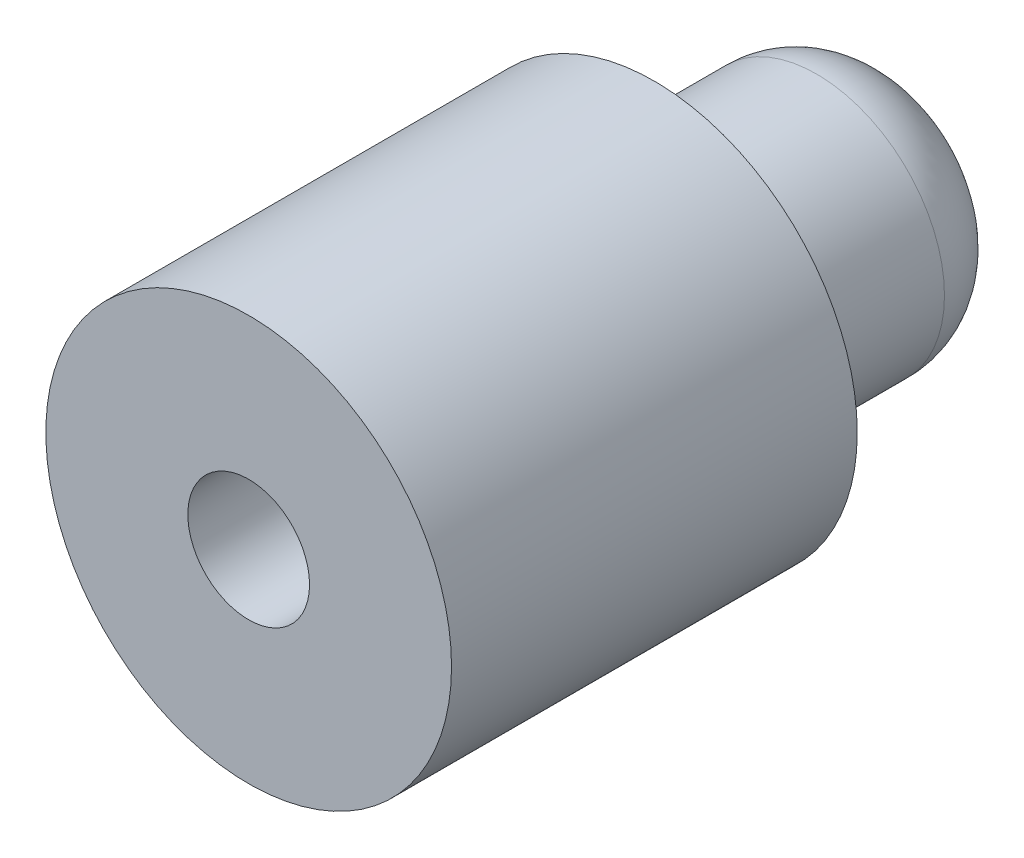
from build123d import *

# Parameters (mm, degrees)
ESQUISSE1_R             = 3.15
BOSS_EXTRU_1_DEPTH      = 6
ESQUISSE3_R             = 5
BOSS_EXTRU_2_DEPTH      = 10
ESQUISSE4_R             = 1.5
ENL_V_MAT_EXTRU_1_DEPTH = 10
CONG_1_R                = 2


with BuildPart() as part:
    # Esquisse1 → Boss.-Extru.1 (new body)
    with BuildSketch(Plane.XY):
        Circle(ESQUISSE1_R)
    extrude(amount=BOSS_EXTRU_1_DEPTH)

    # Esquisse3 → Boss.-Extru.2 (add)
    with BuildSketch(Plane.XY.offset(6)):
        Circle(ESQUISSE3_R)
    extrude(amount=BOSS_EXTRU_2_DEPTH)

    # Esquisse4 → Enlèv. mat.-Extru.1 (cut)
    with BuildSketch(Plane.XY.offset(16)):
        Circle(ESQUISSE4_R)
    extrude(amount=-ENL_V_MAT_EXTRU_1_DEPTH, mode=Mode.SUBTRACT)

    # Congé1
    cong_1_edges = [part.edges().sort_by_distance(p)[0] for p in [
        (-3.15, 0, 0),
    ]]
    fillet(cong_1_edges, radius=CONG_1_R)


solid = part.part
